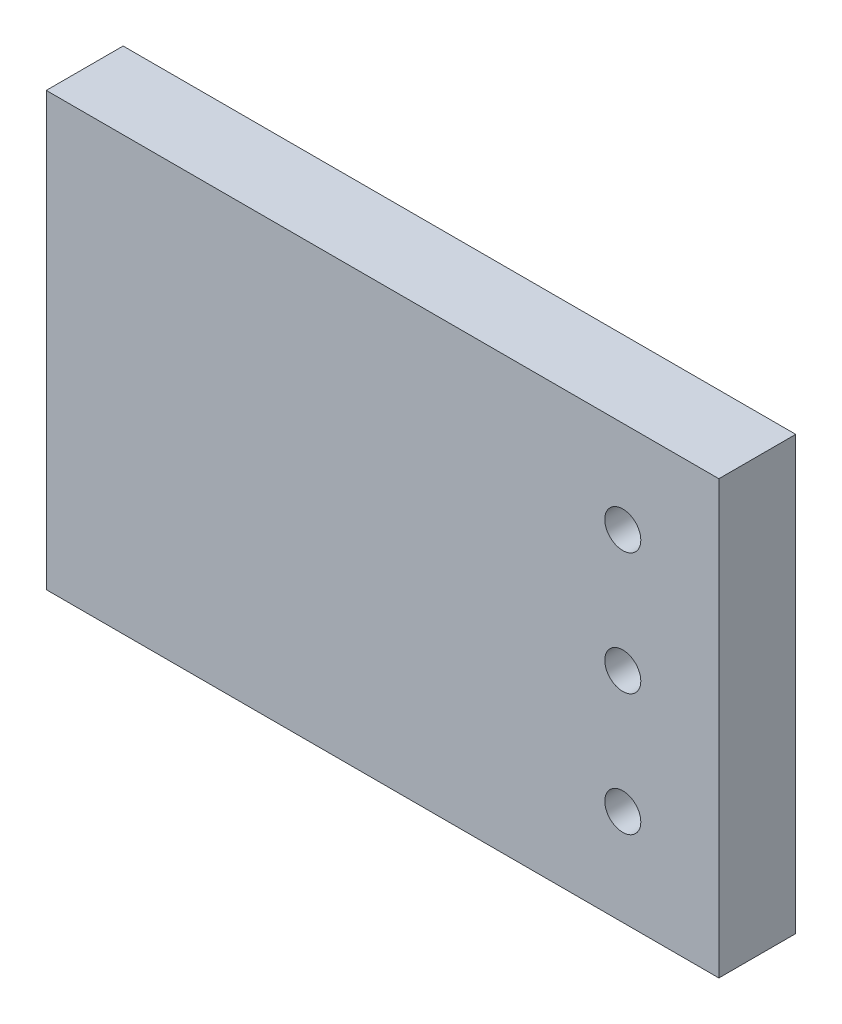
from build123d import *

# Parameters (mm, degrees)
SKETCH1_W           = 14
SKETCH1_H           = 9
BOSS_EXTRUDE1_DEPTH = 1.6
SKETCH2_R           = 0.375
CUT_EXTRUDE1_DEPTH  = 17.720047847


with BuildPart() as part:
    # Sketch1 → Boss-Extrude1 (new body)
    with BuildSketch(Plane.XY):
        with Locations((7, -4.5)):
            Rectangle(SKETCH1_W, SKETCH1_H)
    extrude(amount=BOSS_EXTRUDE1_DEPTH)

    # Sketch2 → Cut-Extrude1 (cut, through all)
    with BuildSketch(Plane.XY.offset(1.6)):
        with Locations((12, -7)):
            Circle(SKETCH2_R)
        with Locations((12, -4.46)):
            Circle(SKETCH2_R)
        with Locations((12, -1.92)):
            Circle(SKETCH2_R)
    extrude(amount=-CUT_EXTRUDE1_DEPTH, mode=Mode.SUBTRACT)


solid = part.part
